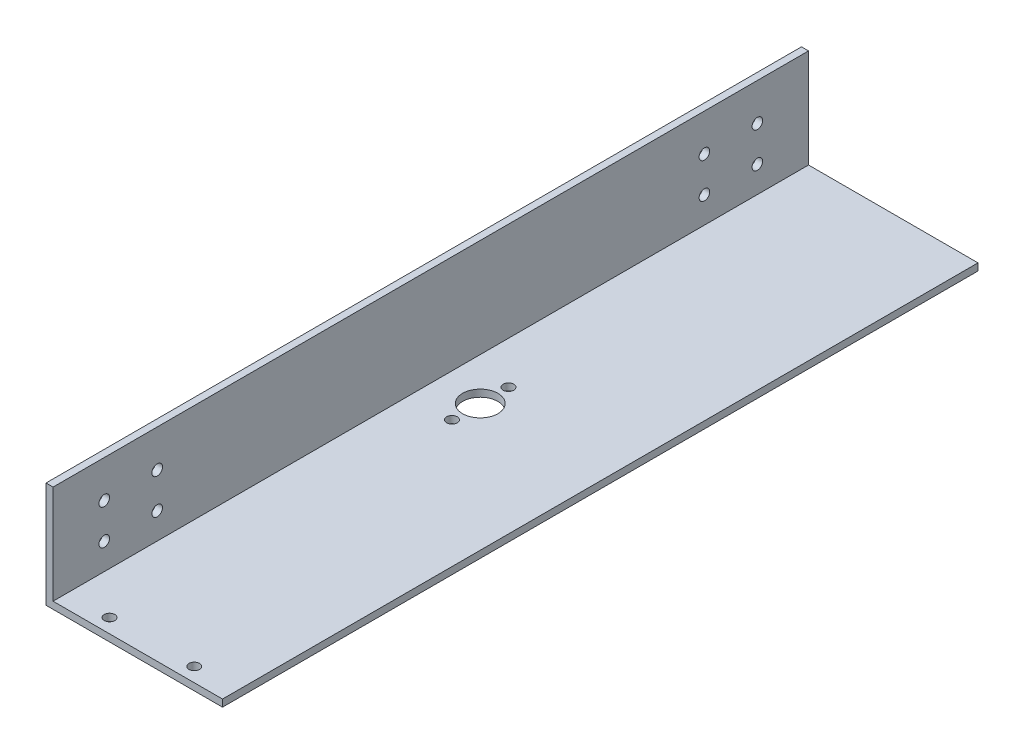
from build123d import *

# Parameters (mm, degrees)
BOSS_EXTRUDE1_DEPTH      = 214
SKETCH2_R                = 5
CUT_EXTRUDE1_DEPTH       = 222.801713249
SKETCH4_R                = 1.500000001
CUT_EXTRUDE3_DEPTH       = 222.801713249
F_3_0_3_DIAMETER_HOLE1_D = 3
F_3_0_3_DIAMETER_HOLE2_D = 3


with BuildPart() as part:
    # Sketch1 → Boss-Extrude1 (new body)
    with BuildSketch(Plane.XY):
        Polygon((0, 0), (0, 30), (2, 30), (2, 2), (50, 2), (50, 0), align=None)
    extrude(amount=BOSS_EXTRUDE1_DEPTH)

    # Sketch2 → Cut-Extrude1 (cut, through all)
    with BuildSketch(Plane.XZ):
        with Locations((14, 105)):
            Circle(SKETCH2_R)
    extrude(amount=-CUT_EXTRUDE1_DEPTH, mode=Mode.SUBTRACT)

    # Sketch4 → Cut-Extrude3 (cut, through all)
    with BuildSketch(Plane(origin=(0, 0, 0), x_dir=(-1, 0, 0), z_dir=(0, -1, 0))):
        with Locations(Location((-14.000000126, -112.999999976, 0), (0, 0, 180))):
            Circle(SKETCH4_R)
        with Locations(Location((-14.000000126, -96.999999976, 0), (0, 0, 180))):
            Circle(SKETCH4_R)
    extrude(amount=-CUT_EXTRUDE3_DEPTH, mode=Mode.SUBTRACT)

    # Ø3.0 (3) Diameter Hole1 (through all)
    with Locations(Plane(origin=(2, 0, 0), x_dir=(0, 0, -1), z_dir=(1, 0, 0))):
        with Locations((-199.5, 9.45), (-199.5, 19.45), (-184.5, 19.450012476), (-184.5, 9.45), (-29.5, 19.45), (-29.5, 9.45), (-14.5, 9.45), (-14.5, 19.45)):
            Hole(F_3_0_3_DIAMETER_HOLE1_D / 2)

    # Ø3.0 (3) Diameter Hole2 (through all)
    with Locations(Plane(origin=(-23.407632793, 2, 151.138003919), x_dir=(0, 0, 1), z_dir=(0, 1, 0))):
        with Locations((58.861996081, 61.407632793), (58.861996081, 37.407632793)):
            Hole(F_3_0_3_DIAMETER_HOLE2_D / 2)


solid = part.part
